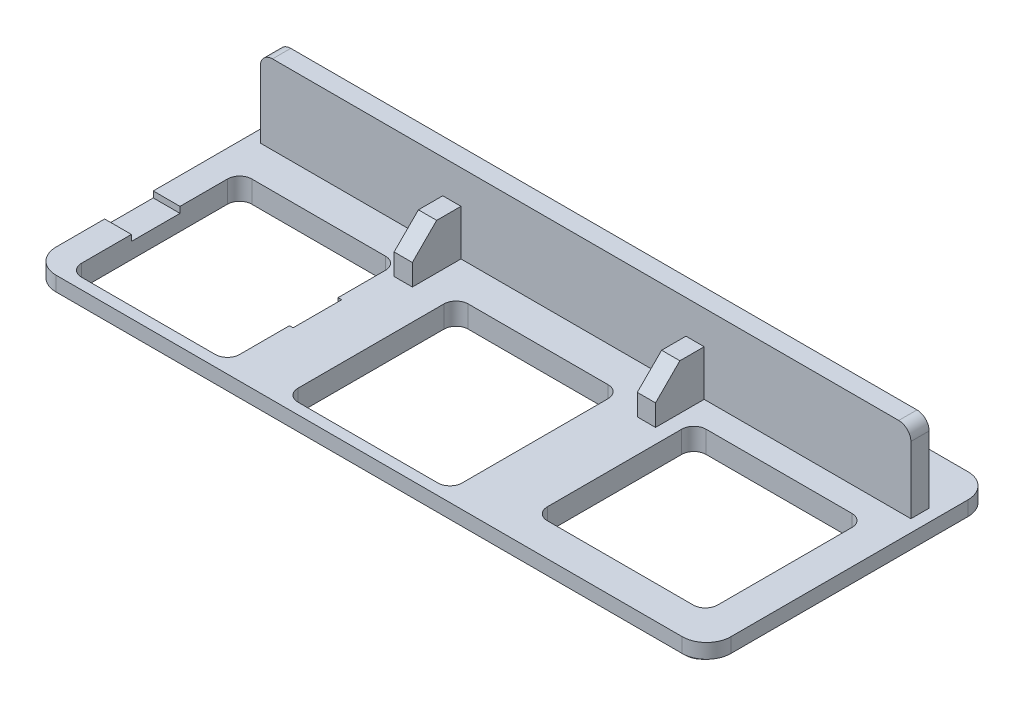
from build123d import *

# Parameters (mm, degrees)
SKETCH_1_W          = 55.5
SKETCH_1_H          = 23.5
EXTRUDE_1_DEPTH     = 1.2
FILLET_1_R          = 2
SKETCH_2_W          = 53.7
SKETCH_2_H          = 22.3
EXTRUDE_2_DEPTH     = 0.6
SKETCH_3_W          = 13
SKETCH_3_H          = 14
SKETCH_3_W_2        = 13.5
SKETCH_3_W_3        = 14
SKETCH_3_H_2        = 13.05
CUT_EXTRUDE_1_DEPTH = 3
FILLET_2_R          = 1
SKETCH_4_W          = 15.5
SKETCH_4_H          = 3.997435945
CUT_EXTRUDE_2_DEPTH = 0.5
SKETCH_5_W          = 53.5
SKETCH_5_H          = 1.5
EXTRUDE_3_DEPTH     = 6.5
FILLET_3_R          = 1
SKETCH_6_W          = 1.5
SKETCH_6_H          = 4
EXTRUDE_4_DEPTH     = 3.75
CHAMFER_1_SIZE      = 2
FILLET_4_R          = 1.5


with BuildPart() as part:
    # 草图1 → 凸台-拉伸1 (new body)
    with BuildSketch(Plane(origin=(0, 0, 0), x_dir=(1, 0, 0), z_dir=(0, 1, 0))):
        Rectangle(SKETCH_1_W, SKETCH_1_H)
    extrude(amount=EXTRUDE_1_DEPTH)

    # 圆角1
    fillet_1_edges = [part.edges().sort_by_distance(p)[0] for p in [
        (27.75, 0.6, 11.75),
        (-27.75, 0.6, 11.75),
        (-27.75, 0.6, -11.75),
        (27.75, 0.6, -11.75),
    ]]
    fillet(fillet_1_edges, radius=FILLET_1_R)

    # 草图2 → 凸台-拉伸2 (add)
    with BuildSketch(Plane.XZ):
        Rectangle(SKETCH_2_W, SKETCH_2_H)
    extrude(amount=EXTRUDE_2_DEPTH)

    # 草图3 → 切除-拉伸1 (cut)
    with BuildSketch(Plane.XZ.offset(0.6)):
        with Locations((-19.05, 3.85)):
            Rectangle(SKETCH_3_W, SKETCH_3_H)
        with Locations((-1, 3.85)):
            Rectangle(SKETCH_3_W_2, SKETCH_3_H)
        with Locations((17.95, 2.516421356)):
            Rectangle(SKETCH_3_W_3, SKETCH_3_H_2)
    extrude(amount=-CUT_EXTRUDE_1_DEPTH, mode=Mode.SUBTRACT)

    # 圆角2
    fillet_2_edges = [part.edges().sort_by_distance(p)[0] for p in [
        (-25.55, 0.3, -3.15),
        (-25.55, 0.3, 10.85),
        (-12.55, 0.3, 10.85),
        (-12.55, 0.3, -3.15),
        (-7.75, 0.3, -3.15),
        (-7.75, 0.3, 10.85),
        (5.75, 0.3, 10.85),
        (5.75, 0.3, -3.15),
        (10.95, 0.3, -4.008578644),
        (10.95, 0.3, 9.041421356),
        (24.95, 0.3, 9.041421356),
        (24.95, 0.3, -4.008578644),
    ]]
    fillet(fillet_2_edges, radius=FILLET_2_R)

    # 草图4 → 切除-拉伸2 (cut)
    with BuildSketch(Plane(origin=(0, 1.2, 0), x_dir=(1, 0, 0), z_dir=(0, 1, 0))):
        with Locations((-20, -3.751282028)):
            Rectangle(SKETCH_4_W, SKETCH_4_H)
    extrude(amount=-CUT_EXTRUDE_2_DEPTH, mode=Mode.SUBTRACT)

    # 草图5 → 凸台-拉伸3 (add)
    with BuildSketch(Plane(origin=(0, 1.2, 0), x_dir=(1, 0, 0), z_dir=(0, 1, 0))):
        with Locations((0, 6.804632487)):
            Rectangle(SKETCH_5_W, SKETCH_5_H)
    extrude(amount=EXTRUDE_3_DEPTH)

    # 圆角3
    fillet_3_edges = [part.edges().sort_by_distance(p)[0] for p in [
        (26.75, 7.7, -6.804632487),
        (-26.75, 7.7, -6.804632487),
    ]]
    fillet(fillet_3_edges, radius=FILLET_3_R)

    # 草图6 → 凸台-拉伸4 (add)
    with BuildSketch(Plane(origin=(0, 1.2, 0), x_dir=(1, 0, 0), z_dir=(0, 1, 0))):
        with Locations((9, 4.054632487)):
            Rectangle(SKETCH_6_W, SKETCH_6_H)
        with Locations((-11, 4.054632487)):
            Rectangle(SKETCH_6_W, SKETCH_6_H)
    extrude(amount=EXTRUDE_4_DEPTH)

    # 倒角1
    chamfer_1_edges = [part.edges().sort_by_distance(p)[0] for p in [
        (9, 4.95, -2.054632487),
        (-11, 4.95, -2.054632487),
    ]]
    chamfer(chamfer_1_edges, length=CHAMFER_1_SIZE)

    # 圆角4
    fillet_4_edges = [part.edges().sort_by_distance(p)[0] for p in [
        (-26.85, -0.3, 11.15),
        (-26.85, -0.3, -11.15),
        (26.85, -0.3, -11.15),
        (26.85, -0.3, 11.15),
    ]]
    fillet(fillet_4_edges, radius=FILLET_4_R)


solid = part.part
